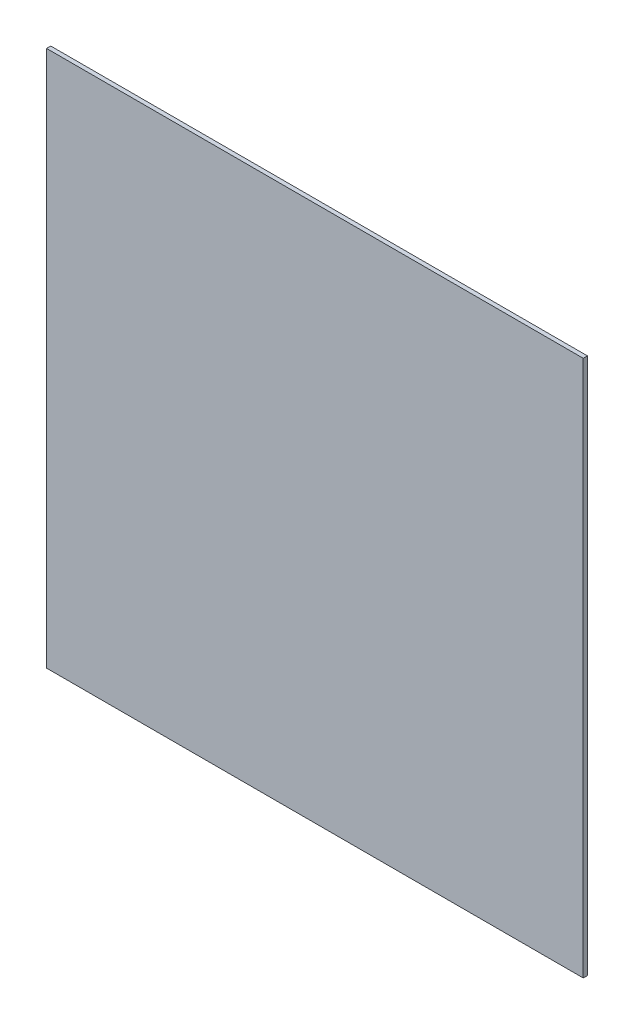
from build123d import *

# Parameters (mm, degrees)
SKETCH1_W           = 609.6
SKETCH1_H           = 609.6
BOSS_EXTRUDE1_DEPTH = 4.7625


with BuildPart() as part:
    # Sketch1 → Boss-Extrude1 (new body)
    with BuildSketch(Plane.XY):
        Rectangle(SKETCH1_W, SKETCH1_H)
    extrude(amount=BOSS_EXTRUDE1_DEPTH)


solid = part.part
